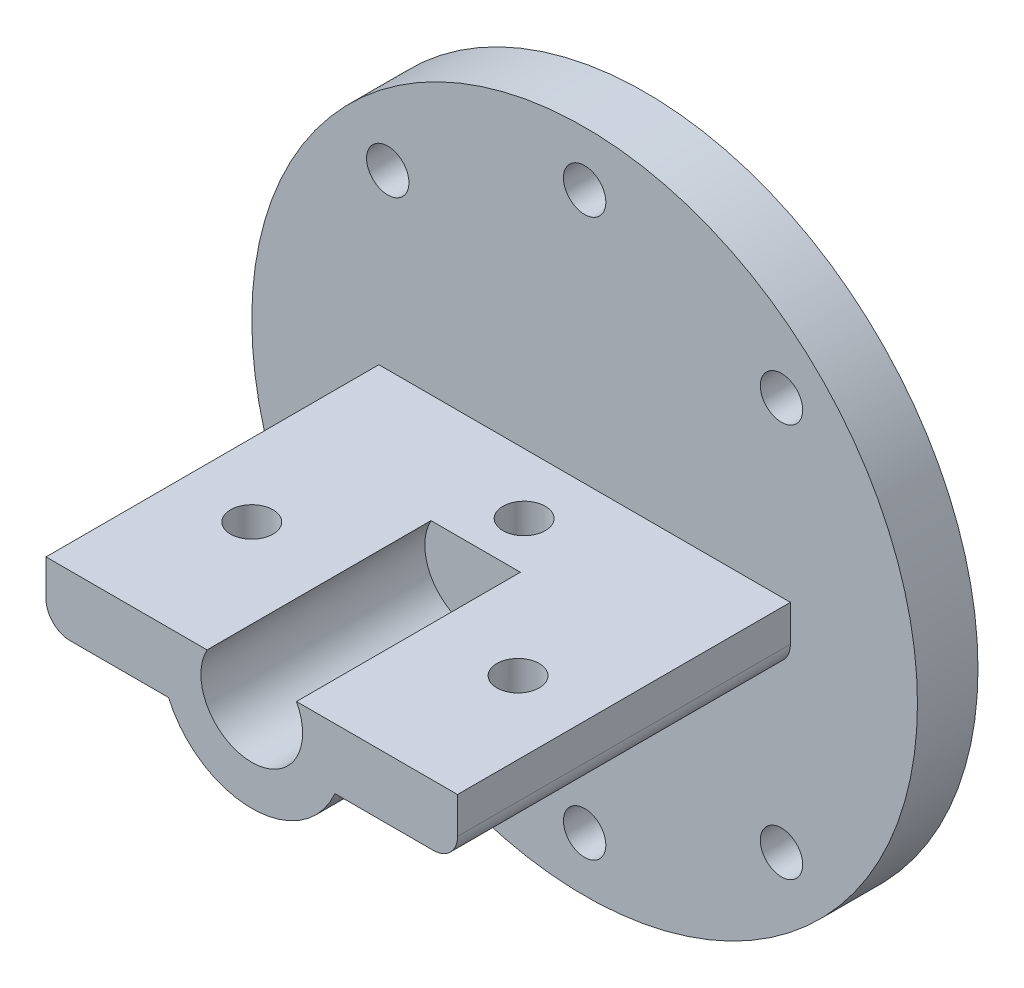
from build123d import *

# Parameters (mm, degrees)
SKETCH1_R           = 7.5
BOSS_EXTRUDE1_DEPTH = 32.5
SKETCH2_R           = 27.5
SKETCH2_R_2         = 7.5
SKETCH2_R_3         = 1.75
BOSS_EXTRUDE2_DEPTH = 5
SKETCH3_W           = 27
SKETCH3_H           = 6
CUT_EXTRUDE1_DEPTH  = 27.5
BOSS_EXTRUDE3_DEPTH = 5
BOSS_EXTRUDE4_DEPTH = 9
BOSS_EXTRUDE5_DEPTH = 27.5
SKETCH7_R           = 1.75
CUT_EXTRUDE2_DEPTH  = 52.795270054
FILLET1_R           = 2


with BuildPart() as part:
    # Sketch1 → Boss-Extrude1 (new body)
    with BuildSketch(Plane.XY):
        Circle(SKETCH1_R)
        with BuildLine():
            Line((-2.720294102, 3.2), (2.720294102, 3.2))
            ThreePointArc((2.720294102, 3.2), (0, -4.2), (-2.720294102, 3.2))
        make_face(mode=Mode.SUBTRACT)
    extrude(amount=BOSS_EXTRUDE1_DEPTH)

    # Sketch2 → Boss-Extrude2 (add)
    with BuildSketch(Plane(origin=(0, 0, 0), x_dir=(-1, 0, 0), z_dir=(0, 0, -1))):
        Circle(SKETCH2_R)
        Circle(SKETCH2_R_2, mode=Mode.SUBTRACT)
        with Locations((0, 23)):
            Circle(SKETCH2_R_3, mode=Mode.SUBTRACT)
        with Locations((16.263455967, 16.263455967)):
            Circle(SKETCH2_R_3, mode=Mode.SUBTRACT)
        with Locations((16.263455967, -16.263455967)):
            Circle(SKETCH2_R_3, mode=Mode.SUBTRACT)
        with Locations((0, -23)):
            Circle(SKETCH2_R_3, mode=Mode.SUBTRACT)
        with Locations((-16.263455967, -16.263455967)):
            Circle(SKETCH2_R_3, mode=Mode.SUBTRACT)
        with Locations((-16.263455967, 16.263455967)):
            Circle(SKETCH2_R_3, mode=Mode.SUBTRACT)
    extrude(amount=-BOSS_EXTRUDE2_DEPTH)

    # Sketch3 → Cut-Extrude1 (cut)
    with BuildSketch(Plane.XY.offset(32.5)):
        with Locations((-1.5, 5)):
            Rectangle(SKETCH3_W, SKETCH3_H)
    extrude(amount=-CUT_EXTRUDE1_DEPTH, mode=Mode.SUBTRACT)

    # Sketch4 → Boss-Extrude3 (add)
    with BuildSketch(Plane(origin=(0, 0, 0), x_dir=(-1, 0, 0), z_dir=(0, 0, -1))):
        with BuildLine():
            Line((-2.720294102, 3.2), (2.720294102, 3.2))
            ThreePointArc((2.720294102, 3.2), (0, -4.2), (-2.720294102, 3.2))
        make_face()
    extrude(amount=-BOSS_EXTRUDE3_DEPTH)

    # Sketch5 → Boss-Extrude4 (add)
    with BuildSketch(Plane.XY.offset(5)):
        with BuildLine():
            Line((-3.693237063, 2), (3.693237063, 2))
            ThreePointArc((3.693237063, 2), (0, -4.2), (-3.693237063, 2))
        make_face()
    extrude(amount=BOSS_EXTRUDE4_DEPTH)

    # Sketch6 → Boss-Extrude5 (add)
    with BuildSketch(Plane.XY.offset(5)):
        with BuildLine():
            Line((-7.228416147, 2), (-17, 2))
            Line((-17, 2), (-17, -3))
            Line((-17, -3), (-6.873863542, -3))
            ThreePointArc((-6.873863542, -3), (-7.481214682, -0.530496831), (-7.228416147, 2))
        make_face()
        with BuildLine():
            Line((6.873863542, -3), (17, -3))
            Line((17, -3), (17, 2))
            Line((17, 2), (7.228416147, 2))
            ThreePointArc((7.228416147, 2), (7.481214682, -0.530496831), (6.873863542, -3))
        make_face()
    extrude(amount=BOSS_EXTRUDE5_DEPTH)

    # Sketch7 → Cut-Extrude2 (cut, through all)
    with BuildSketch(Plane(origin=(0, 2, 0), x_dir=(1, 0, 0), z_dir=(0, 1, 0))):
        with Locations(Location((0, -10, 0), (0, 0, 270))):
            Circle(SKETCH7_R)
        with Locations(Location((-11, -21.5, 0), (0, 0, 270))):
            Circle(SKETCH7_R)
        with Locations(Location((11, -21.5, 0), (0, 0, 270))):
            Circle(SKETCH7_R)
    extrude(amount=-CUT_EXTRUDE2_DEPTH, mode=Mode.SUBTRACT)

    # Fillet1
    fillet1_edges = [part.edges().sort_by_distance(p)[0] for p in [
        (-17, -3, 18.75),
        (17, -3, 18.75),
    ]]
    fillet(fillet1_edges, radius=FILLET1_R)


solid = part.part
